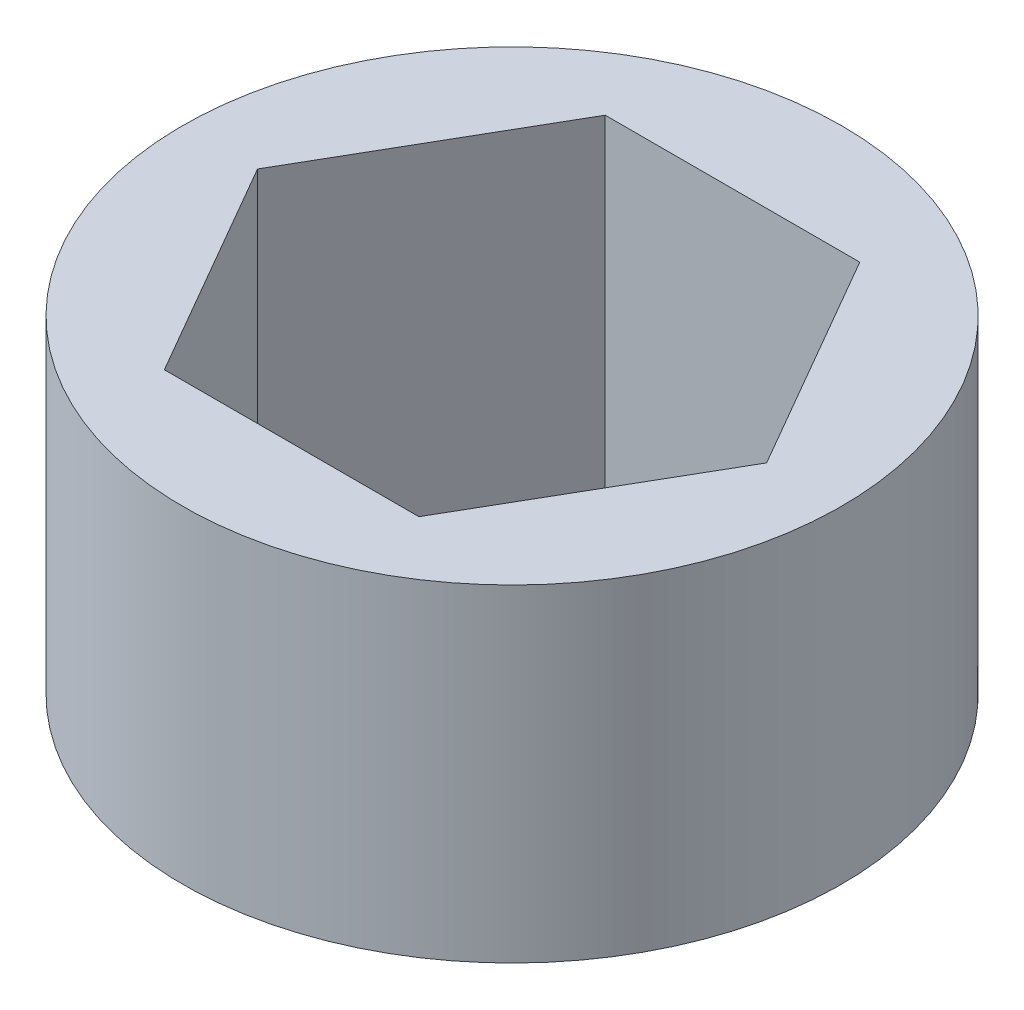
from build123d import *

# Parameters (mm, degrees)
SKETCH1_R           = 9.5885
BOSS_EXTRUDE1_DEPTH = 9.525


with BuildPart() as part:
    # Sketch1 → Boss-Extrude1 (new body)
    with BuildSketch(Plane(origin=(0, 0, 0), x_dir=(1, 0, 0), z_dir=(0, 1, 0))):
        with Locations(Location((0, 0, 0), (0, 0, 90))):
            Circle(SKETCH1_R)
        Polygon((3.702835951, 6.4135), (-3.702835951, 6.4135), (-7.405671903, 0), (-3.702835951, -6.4135), (3.702835951, -6.4135), (7.405671903, 0), align=None, mode=Mode.SUBTRACT)
    extrude(amount=BOSS_EXTRUDE1_DEPTH)


solid = part.part
